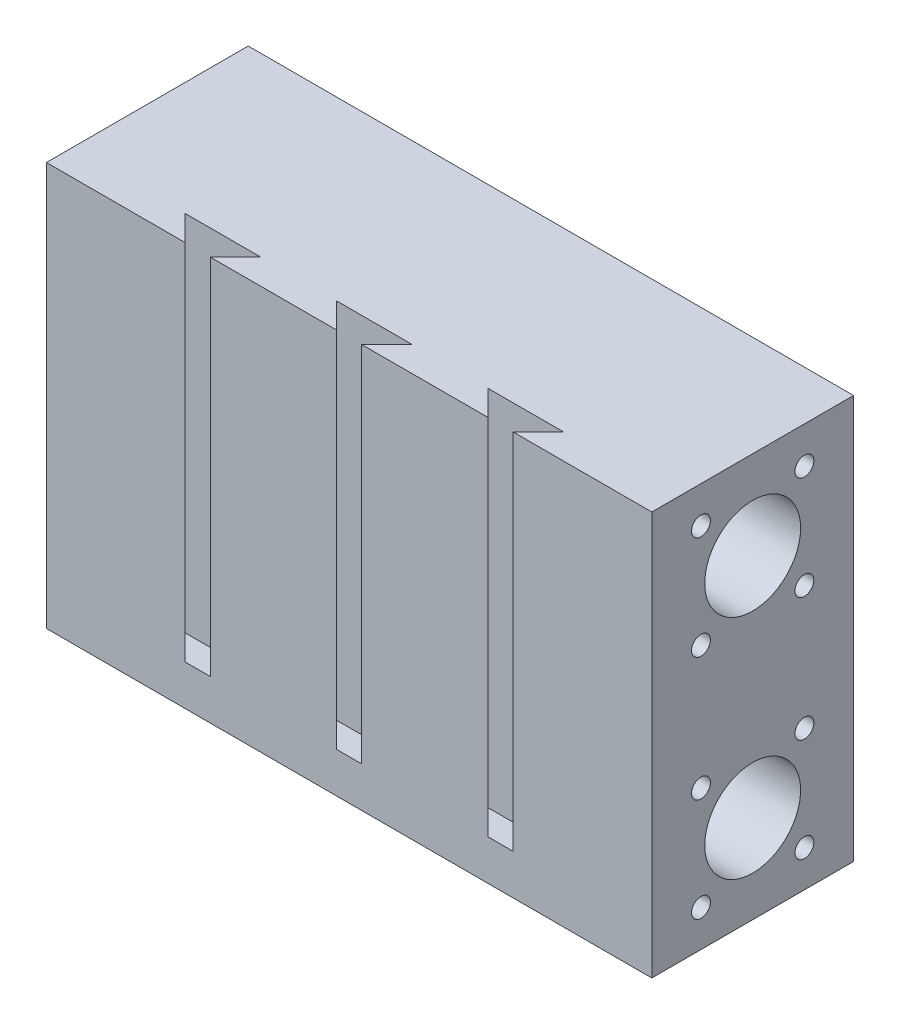
from build123d import *

# Parameters (mm, degrees)
SKETCH1_W                        = 120
SKETCH1_H                        = 80
BOSS_EXTRUDE1_DEPTH              = 40
SKETCH2_R                        = 1.85
LINEAR_BEARING_SCREW_CUTS_DEPTH  = 14
SKETCH3_R                        = 9.5
LINEAR_BEARINGS_HOLE_DEPTH       = 55
SKETCH4_R                        = 1.875
LINEAR_BEARING_SCREW_CUTS2_DEPTH = 14
LINEAR_BEARINGS_HOLE2_START      = -55
SKETCH5_R                        = 9.5
LINEAR_BEARINGS_HOLE2_DEPTH      = 55
CUT_EXTRUDE7_DEPTH               = 72


with BuildPart() as part:
    # Sketch1 → Boss-Extrude1 (new body)
    with BuildSketch(Plane.XY):
        with Locations((60, 40)):
            Rectangle(SKETCH1_W, SKETCH1_H)
    extrude(amount=BOSS_EXTRUDE1_DEPTH)

    # Sketch2 → linear-bearing-screw-cuts (cut)
    with BuildSketch(Plane.ZY):
        with Locations((30.25, 72.75)):
            Circle(SKETCH2_R)
        with Locations(Location((9.75, 72.75, 0), (0, 0, 180))):
            Circle(SKETCH2_R)
        with Locations(Location((30.25, 52.25, 0), (0, 0, 180))):
            Circle(SKETCH2_R)
        with Locations((9.75, 52.25)):
            Circle(SKETCH2_R)
        with Locations(Location((9.75, 27.75, 0), (0, 0, 180))):
            Circle(SKETCH2_R)
        with Locations((30.25, 27.75)):
            Circle(SKETCH2_R)
        with Locations(Location((30.25, 7.25, 0), (0, 0, 180))):
            Circle(SKETCH2_R)
        with Locations((9.75, 7.25)):
            Circle(SKETCH2_R)
    extrude(amount=-LINEAR_BEARING_SCREW_CUTS_DEPTH, mode=Mode.SUBTRACT)

    # Sketch3 → linear-bearings-hole (cut)
    with BuildSketch(Plane.ZY):
        with Locations((20, 62.5)):
            Circle(SKETCH3_R)
        with Locations(Location((20, 17.5, 0), (0, 0, 180))):
            Circle(SKETCH3_R)
    extrude(amount=-LINEAR_BEARINGS_HOLE_DEPTH, mode=Mode.SUBTRACT)

    # Sketch4 → linear-bearing-screw-cuts2 (cut)
    with BuildSketch(Plane(origin=(120, 0, 0), x_dir=(0, 0, -1), z_dir=(1, 0, 0))):
        with Locations((-9.75, 72.75)):
            Circle(SKETCH4_R)
        with Locations(Location((-30.25, 72.75, 0), (0, 0, 180))):
            Circle(SKETCH4_R)
        with Locations(Location((-9.75, 52.25, 0), (0, 0, 180))):
            Circle(SKETCH4_R)
        with Locations((-30.25, 52.25)):
            Circle(SKETCH4_R)
        with Locations(Location((-30.25, 27.75, 0), (0, 0, 180))):
            Circle(SKETCH4_R)
        with Locations((-9.75, 27.75)):
            Circle(SKETCH4_R)
        with Locations(Location((-9.75, 7.25, 0), (0, 0, 180))):
            Circle(SKETCH4_R)
        with Locations((-30.25, 7.25)):
            Circle(SKETCH4_R)
    extrude(amount=-LINEAR_BEARING_SCREW_CUTS2_DEPTH, mode=Mode.SUBTRACT)

    # Sketch5 → linear-bearings-hole2 (cut)
    with BuildSketch(Plane(origin=(120, 0, 0), x_dir=(0, 0, -1), z_dir=(1, 0, 0)).offset(LINEAR_BEARINGS_HOLE2_START)):
        with Locations(Location((-20, 62.5, 0), (0, 0, 180))):
            Circle(SKETCH5_R)
        with Locations((-20, 17.5)):
            Circle(SKETCH5_R)
    extrude(amount=LINEAR_BEARINGS_HOLE2_DEPTH, mode=Mode.SUBTRACT)

    # Sketch10 → Cut-Extrude7 (cut)
    with BuildSketch(Plane(origin=(0, 80, 0), x_dir=(1, 0, 0), z_dir=(0, 1, 0))):
        Polygon((92.5, -40), (97.5, -35), (82.5, -35), (87.5, -40), align=None)
        Polygon((67.5, -35), (62.5, -40), (57.5, -40), (52.5, -35), align=None)
        Polygon((37.5, -35), (32.5, -40), (27.5, -40), (22.5, -35), align=None)
    extrude(amount=-CUT_EXTRUDE7_DEPTH, mode=Mode.SUBTRACT)


solid = part.part
